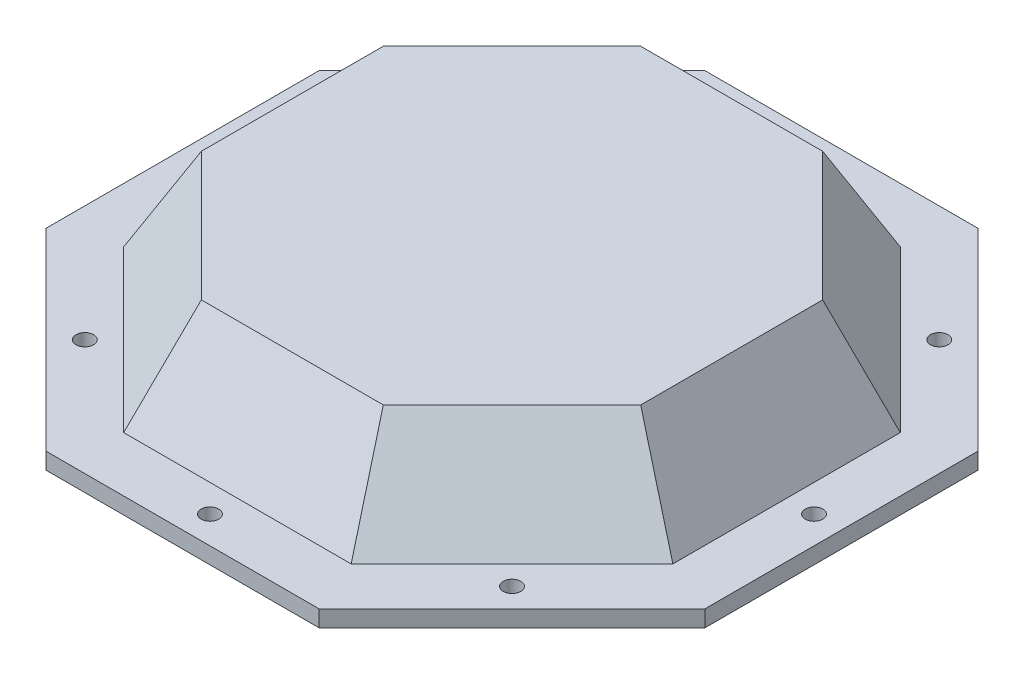
from build123d import *

# Parameters (mm, degrees)
SKETCH2_R           = 1.6
BOSS_EXTRUDE1_DEPTH = 3
CUT_EXTRUDE1_DEPTH  = 85.905830189
BOSS_EXTRUDE2_DEPTH = 3
SHELL1_T            = -2
BOSS_EXTRUDE4_DEPTH = 3


with BuildPart() as part:
    # Sketch2 → Boss-Extrude1 (new body)
    with BuildSketch(Plane(origin=(0, 0, 0), x_dir=(1, 0, 0), z_dir=(0, 1, 0))):
        Polygon((-24.852813742, 60), (-60, 24.852813742), (-60, -24.852813742), (-24.852813742, -60), (24.852813742, -60), (60, -24.852813742), (60, 24.852813742), (24.852813742, 60), align=None)
        with Locations(Location((-38.890872965, -38.890872965, 0), (0, 0, 270))):
            Circle(SKETCH2_R, mode=Mode.SUBTRACT)
        with Locations(Location((38.890872965, 38.890872965, 0), (0, 0, 270))):
            Circle(SKETCH2_R, mode=Mode.SUBTRACT)
        with Locations(Location((0, -55, 0), (0, 0, 270))):
            Circle(SKETCH2_R, mode=Mode.SUBTRACT)
        with Locations(Location((0, 55, 0), (0, 0, 270))):
            Circle(SKETCH2_R, mode=Mode.SUBTRACT)
        with Locations(Location((38.890872965, -38.890872965, 0), (0, 0, 270))):
            Circle(SKETCH2_R, mode=Mode.SUBTRACT)
        with Locations(Location((-38.890872965, 38.890872965, 0), (0, 0, 270))):
            Circle(SKETCH2_R, mode=Mode.SUBTRACT)
        with Locations(Location((55, 0, 0), (0, 0, 270))):
            Circle(SKETCH2_R, mode=Mode.SUBTRACT)
        with Locations(Location((-55, 0, 0), (0, 0, 270))):
            Circle(SKETCH2_R, mode=Mode.SUBTRACT)
    extrude(amount=BOSS_EXTRUDE1_DEPTH)

    # Sketch3 → Cut-Extrude1 (cut, through all)
    with BuildSketch(Plane(origin=(0, 3, 0), x_dir=(1, 0, 0), z_dir=(0, 1, 0))):
        Polygon((20.710678119, 50), (-20.710678119, 50), (-50, 20.710678119), (-50, -20.710678119), (-20.710678119, -50), (20.710678119, -50), (50, -20.710678119), (50, 20.710678119), align=None)
    extrude(amount=-CUT_EXTRUDE1_DEPTH, mode=Mode.SUBTRACT)



with BuildPart() as body_2:
    # Sketch4 → Boss-Extrude2 (new body)
    with BuildSketch(Plane(origin=(0, 18, 0), x_dir=(1, 0, 0), z_dir=(0, 1, 0))):
        Polygon((-40, 16.568542495), (-40, -16.568542495), (-16.568542495, -40), (16.568542495, -40), (40, -16.568542495), (40, 16.568542495), (16.568542495, 40), (-16.568542495, 40), align=None)
    extrude(amount=BOSS_EXTRUDE2_DEPTH)

    # Sketch3<3> → section 0 of loft1
    with BuildSketch(Plane(origin=(0, 3, 0), x_dir=(1, 0, 0), z_dir=(0, 1, 0)), mode=Mode.PRIVATE) as loft1_s0:
        with BuildLine():
            Line((-50, 20.710678119), (-50, -20.710678119))
            Line((-50, -20.710678119), (-20.710678119, -50))
            Line((-20.710678119, -50), (20.710678119, -50))
            Line((20.710678119, -50), (50, -20.710678119))
            Line((50, -20.710678119), (50, 20.710678119))
            Line((50, 20.710678119), (20.710678119, 50))
            Line((20.710678119, 50), (-20.710678119, 50))
            Line((-20.710678119, 50), (-50, 20.710678119))
        make_face()
    # loft up to a face of the part (loft1)
    loft([loft1_s0.sketch, body_2.faces().sort_by_distance((0, 21, 0))[0]])

    # Shell1
    shell1_openings = [body_2.faces().sort_by_distance(p)[0] for p in [
        (0, 3, 0),
    ]]
    offset(amount=SHELL1_T, openings=shell1_openings, kind=Kind.INTERSECTION)


with BuildPart() as part_1:
    add(part.part)

    add(body_2.part)  # Boss-Extrude4 merges body 2
    # Sketch5 → Boss-Extrude4 (add)
    with BuildSketch(Plane.XZ.offset(-3)):
        Polygon((-50, 20.710678119), (-50, -20.710678119), (-20.710678119, -50), (20.710678119, -50), (50, -20.710678119), (50, 20.710678119), (20.710678119, 50), (-20.710678119, 50), align=None)
        Polygon((-47.712082191, 19.762991533), (-47.712082191, -19.762991533), (-19.762991533, -47.712082191), (19.762991533, -47.712082191), (47.712082191, -19.762991533), (47.712082191, 19.762991533), (19.762991533, 47.712082191), (-19.762991533, 47.712082191), align=None, mode=Mode.SUBTRACT)
    extrude(amount=BOSS_EXTRUDE4_DEPTH)


solid = part_1.part
